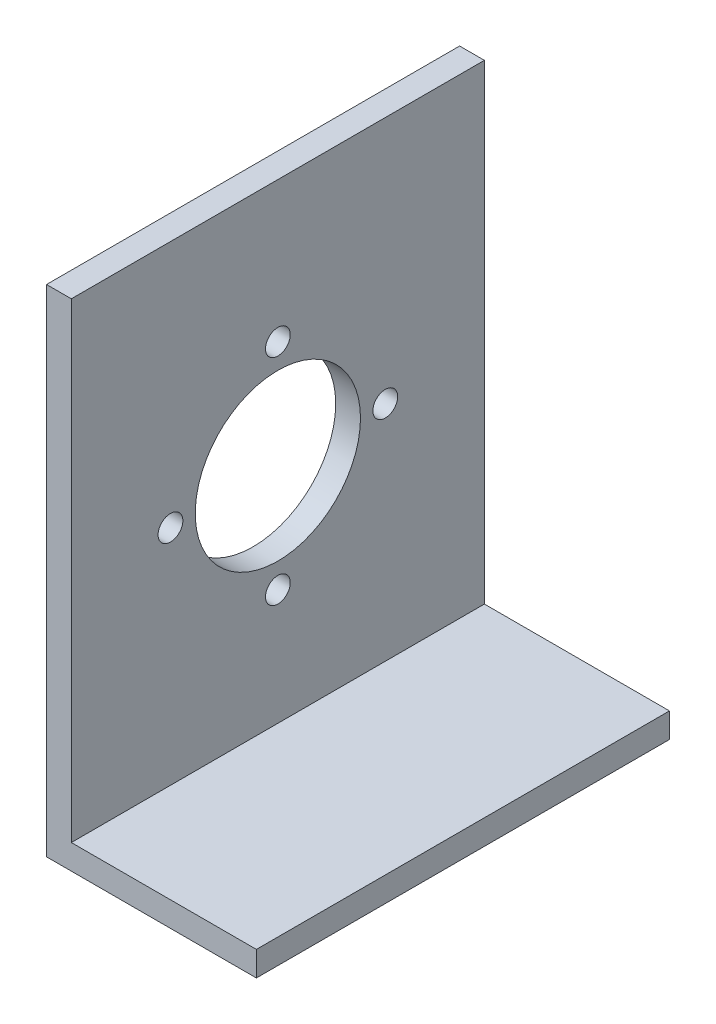
from build123d import *

# Parameters (mm, degrees)
BOSS_EXTRUDE1_DEPTH = 50
SKETCH2_R           = 10
SKETCH2_R_2         = 1.5
CUT_EXTRUDE1_DEPTH  = 50


with BuildPart() as part:
    # Sketch1 → Boss-Extrude1 (new body)
    with BuildSketch(Plane.XY):
        Polygon((0, 0), (0, -60), (25.4, -60), (25.4, -57), (3, -57), (3, 0), align=None)
    extrude(amount=BOSS_EXTRUDE1_DEPTH)

    # Sketch2 → Cut-Extrude1 (cut)
    with BuildSketch(Plane(origin=(3, 0, 0), x_dir=(0, 0, -1), z_dir=(1, 0, 0))):
        with Locations((-25, -30)):
            Circle(SKETCH2_R)
        with Locations((-25, -17)):
            Circle(SKETCH2_R_2)
        with Locations((-12, -30)):
            Circle(SKETCH2_R_2)
        with Locations((-25, -43)):
            Circle(SKETCH2_R_2)
        with Locations((-38, -30)):
            Circle(SKETCH2_R_2)
    extrude(amount=-CUT_EXTRUDE1_DEPTH, mode=Mode.SUBTRACT)


solid = part.part
